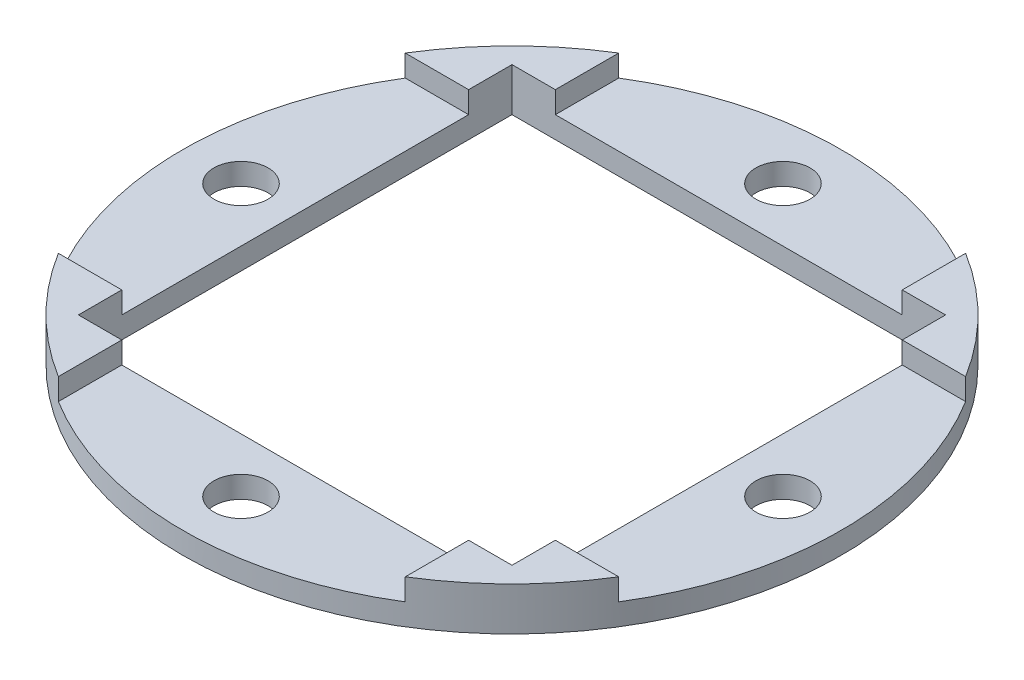
from build123d import *

# Parameters (mm, degrees)
SKETCH1_R           = 76
SKETCH1_W           = 100
SKETCH1_H           = 100
BOSS_EXTRUDE1_DEPTH = 5
SKETCH2_R           = 6.25
CUT_EXTRUDE1_DEPTH  = 10
BOSS_EXTRUDE2_DEPTH = 5


with BuildPart() as part:
    # Sketch1 → Boss-Extrude1 (new body)
    with BuildSketch(Plane(origin=(0, 0, 0), x_dir=(1, 0, 0), z_dir=(0, 1, 0))):
        with Locations(Location((0, 0, 0), (0, 0, 270))):
            Circle(SKETCH1_R)
        Rectangle(SKETCH1_W, SKETCH1_H, mode=Mode.SUBTRACT)
    extrude(amount=BOSS_EXTRUDE1_DEPTH)

    # Sketch2 → Cut-Extrude1 (cut)
    with BuildSketch(Plane(origin=(0, 5, 0), x_dir=(1, 0, 0), z_dir=(0, 1, 0))):
        with Locations(Location((-62.5, 0, 0), (0, 0, 270))):
            Circle(SKETCH2_R)
        with Locations(Location((0, 62.5, 0), (0, 0, 270))):
            Circle(SKETCH2_R)
        with Locations(Location((62.5, 0, 0), (0, 0, 270))):
            Circle(SKETCH2_R)
        with Locations(Location((0, -62.5, 0), (0, 0, 270))):
            Circle(SKETCH2_R)
    extrude(amount=-CUT_EXTRUDE1_DEPTH, mode=Mode.SUBTRACT)

    # Sketch3 → Boss-Extrude2 (add)
    with BuildSketch(Plane(origin=(0, 5, 0), x_dir=(1, 0, 0), z_dir=(0, 1, 0))):
        with BuildLine():
            Line((50, -50), (40, -50))
            Line((40, -50), (40, -64.621977686))
            ThreePointArc((40, -64.621977686), (53.74011537, -53.74011537), (64.621977686, -40))
            Line((64.621977686, -40), (50, -40))
            Line((50, -40), (50, -50))
        make_face()
        with BuildLine():
            Line((-40, -50), (-50, -50))
            Line((-50, -50), (-50, -40))
            Line((-50, -40), (-64.621977686, -40))
            ThreePointArc((-64.621977686, -40), (-53.74011537, -53.74011537), (-40, -64.621977686))
            Line((-40, -64.621977686), (-40, -50))
        make_face()
        with BuildLine():
            Line((-64.621977686, 40), (-50, 40))
            Line((-50, 40), (-50, 50))
            Line((-50, 50), (-40, 50))
            Line((-40, 50), (-40, 64.621977686))
            ThreePointArc((-40, 64.621977686), (-53.74011537, 53.74011537), (-64.621977686, 40))
        make_face()
        with BuildLine():
            Line((50, 50), (50, 40))
            Line((50, 40), (64.621977686, 40))
            ThreePointArc((64.621977686, 40), (53.74011537, 53.74011537), (40, 64.621977686))
            Line((40, 64.621977686), (40, 50))
            Line((40, 50), (50, 50))
        make_face()
    extrude(amount=BOSS_EXTRUDE2_DEPTH)


solid = part.part
